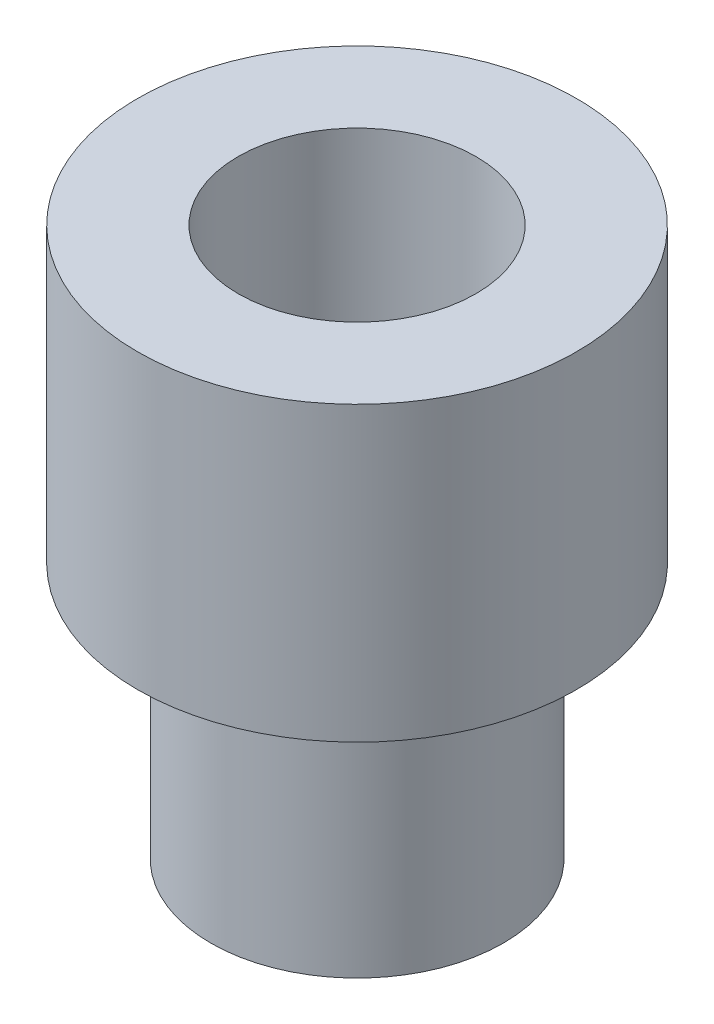
from build123d import *
from build123d.topology import SkipClean

# Parameters (mm, degrees)
CROQUIS1_R              = 6
CROQUIS1_R_2            = 3.25
SALIENTE_EXTRUIR1_DEPTH = 8
SALIENTE_EXTRUIR2_START = 7
CROQUIS2_R              = 4
CROQUIS2_R_2            = 3.25
SALIENTE_EXTRUIR2_DEPTH = 7


with BuildPart() as part:
    # Croquis1 → Saliente-Extruir1 (new body)
    with BuildSketch(Plane(origin=(0, 0, 0), x_dir=(1, 0, 0), z_dir=(0, 1, 0))):
        with Locations(Location((0, 0, 0), (0, 0, 270))):
            Circle(CROQUIS1_R)
        with Locations(Location((0, 0, 0), (0, 0, 270))):
            Circle(CROQUIS1_R_2, mode=Mode.SUBTRACT)
    extrude(amount=SALIENTE_EXTRUIR1_DEPTH)

    # Croquis2 → Saliente-Extruir2 (add)
    with SkipClean():  # the faces are left unmerged after this step: merging them gives an invalid solid
        with BuildSketch(Plane.XZ.offset(SALIENTE_EXTRUIR2_START)):
            with Locations(Location((0, 0, 0), (0, 0, 90))):
                Circle(CROQUIS2_R)
            with Locations(Location((0, 0, 0), (0, 0, 270))):
                Circle(CROQUIS2_R_2, mode=Mode.SUBTRACT)
        extrude(amount=-SALIENTE_EXTRUIR2_DEPTH)


solid = part.part
